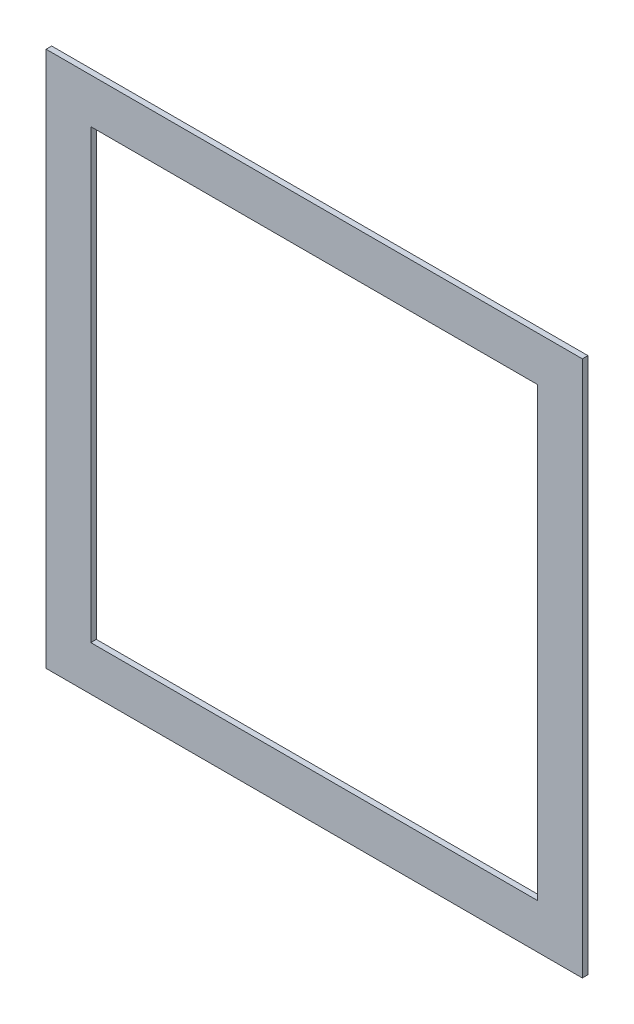
from build123d import *

# Parameters (mm, degrees)
SKETCH1_W           = 152.4
SKETCH1_H           = 152.4
SKETCH1_W_2         = 127
SKETCH1_H_2         = 127
BOSS_EXTRUDE1_DEPTH = 1.5875


with BuildPart() as part:
    # Sketch1 → Boss-Extrude1 (new body)
    with BuildSketch(Plane.XY):
        with Locations((7.123281263, -28.826606557)):
            Rectangle(SKETCH1_W, SKETCH1_H)
        with Locations((7.123281263, -28.826606557)):
            Rectangle(SKETCH1_W_2, SKETCH1_H_2, mode=Mode.SUBTRACT)
    extrude(amount=BOSS_EXTRUDE1_DEPTH)


solid = part.part
